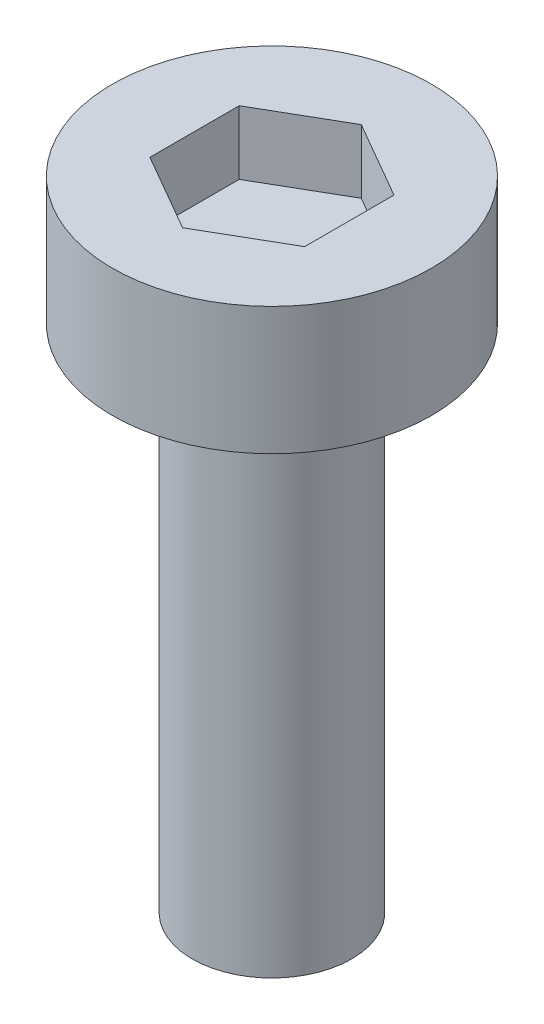
from build123d import *

# Parameters (mm, degrees)
CUT_EXTRUDE1_DEPTH = 2


with BuildPart() as part:
    # Sketch1 → Revolve1 (revolve)
    with BuildSketch(Plane.XY):
        Polygon((0, 0), (0, 20), (5, 20), (5, 16), (2.5, 16), (2.5, 0), align=None)
    revolve(axis=Axis((0, 0, 0), (0, 1, 0)))

    # Sketch2 → Cut-Extrude1 (cut)
    with BuildSketch(Plane(origin=(0, 20, 0), x_dir=(1, 0, 0), z_dir=(0, 1, 0))):
        Polygon((0, -2.800148806), (2.425, -1.400074403), (2.425, 1.400074403), (0, 2.800148806), (-2.425, 1.400074403), (-2.425, -1.400074403), align=None)
    extrude(amount=-CUT_EXTRUDE1_DEPTH, mode=Mode.SUBTRACT)


solid = part.part
